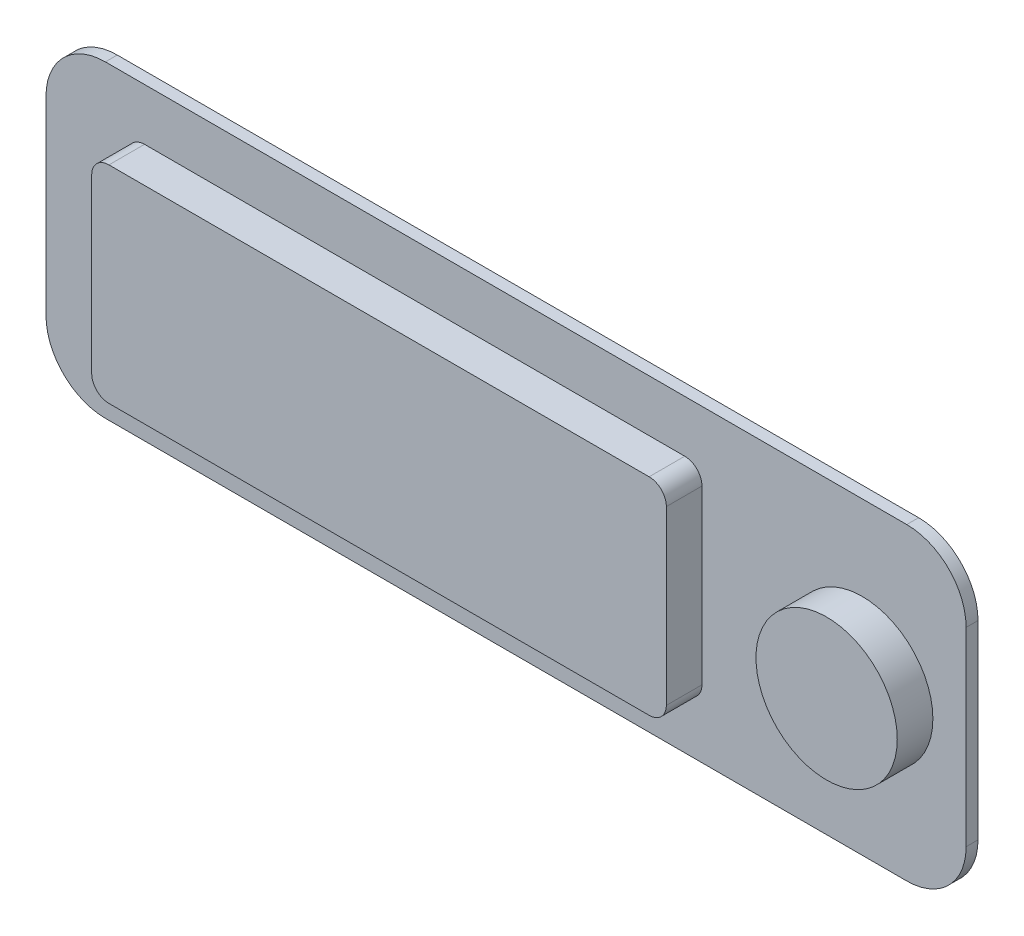
from build123d import *

# Parameters (mm, degrees)
ESQUISSE1_W        = 155
ESQUISSE1_H        = 52
BOSS_EXTRU_1_DEPTH = 2
CONG_1_R           = 10
ESQUISSE2_R        = 11.9
BOSS_EXTRU_2_DEPTH = 6


with BuildPart() as part:
    # Esquisse1 → Boss.-Extru.1 (new body)
    with BuildSketch(Plane.XY):
        with Locations((29.422862753, 9.505149502)):
            Rectangle(ESQUISSE1_W, ESQUISSE1_H)
    extrude(amount=BOSS_EXTRU_1_DEPTH)

    # Congé1
    cong_1_edges = [part.edges().sort_by_distance(p)[0] for p in [
        (-48.077137247, 35.505149502, 1),
        (106.922862753, 35.505149502, 1),
        (106.922862753, -16.494850498, 1),
        (-48.077137247, -16.494850498, 1),
    ]]
    fillet(cong_1_edges, radius=CONG_1_R)

    # Esquisse2 → Boss.-Extru.2 (add)
    with BuildSketch(Plane.XY.offset(2)):
        with Locations((89.422862753, 9.375368795)):
            Circle(ESQUISSE2_R)
        with BuildLine():
            Line((-31.477137247, -8.024631205), (59.522862753, -8.024631205))
            ThreePointArc((59.522862753, -8.024631205), (61.573472418, -7.17524087), (62.422862753, -5.124631205))
            Line((62.422862753, -5.124631205), (62.422862753, 23.875368795))
            ThreePointArc((62.422862753, 23.875368795), (61.573472418, 25.925978461), (59.522862753, 26.775368795))
            Line((59.522862753, 26.775368795), (-31.477137247, 26.775368795))
            ThreePointArc((-31.477137247, 26.775368795), (-33.527746913, 25.925978461), (-34.377137247, 23.875368795))
            Line((-34.377137247, 23.875368795), (-34.377137247, -5.124631205))
            ThreePointArc((-34.377137247, -5.124631205), (-33.527746913, -7.17524087), (-31.477137247, -8.024631205))
        make_face()
    extrude(amount=BOSS_EXTRU_2_DEPTH)


solid = part.part
